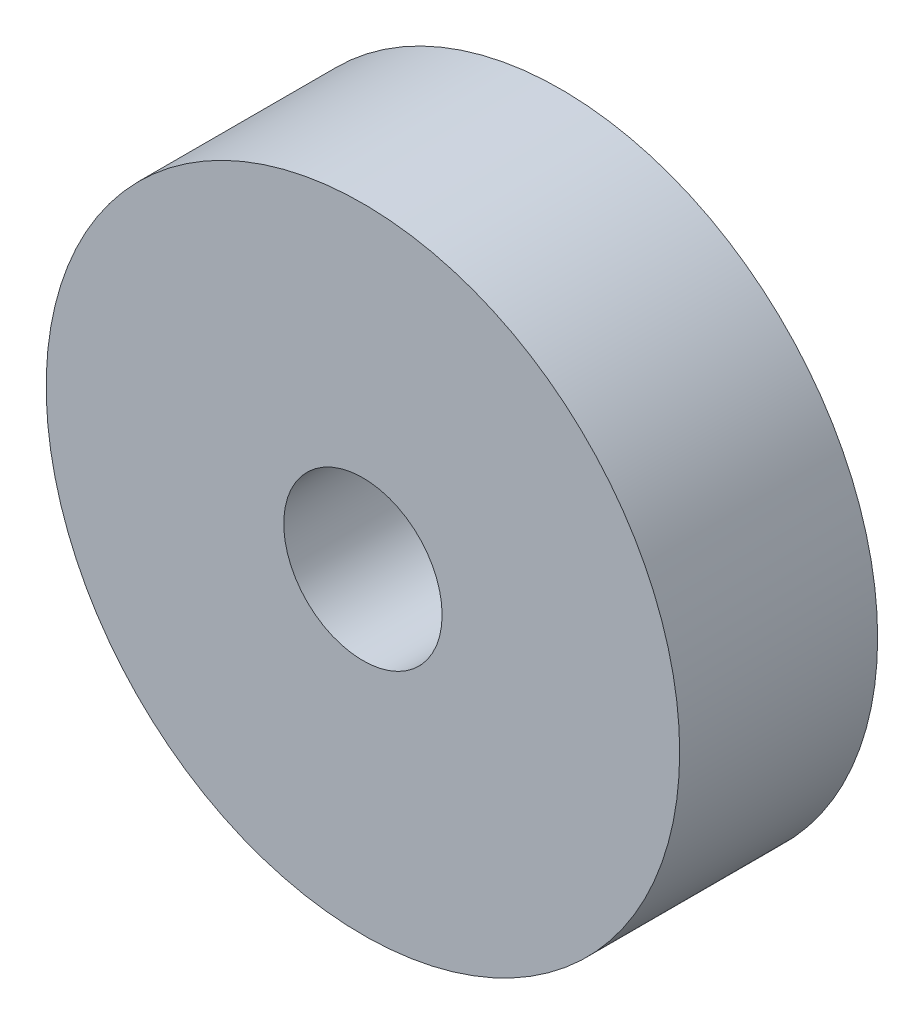
from build123d import *

# Parameters (mm, degrees)
SKETCH_1_R      = 8
SKETCH_1_R_2    = 2
EXTRUDE_1_DEPTH = 5


with BuildPart() as part:
    # 草图1 → 凸台-拉伸1 (new body)
    with BuildSketch(Plane.XY):
        Circle(SKETCH_1_R)
        Circle(SKETCH_1_R_2, mode=Mode.SUBTRACT)
    extrude(amount=EXTRUDE_1_DEPTH)


solid = part.part
